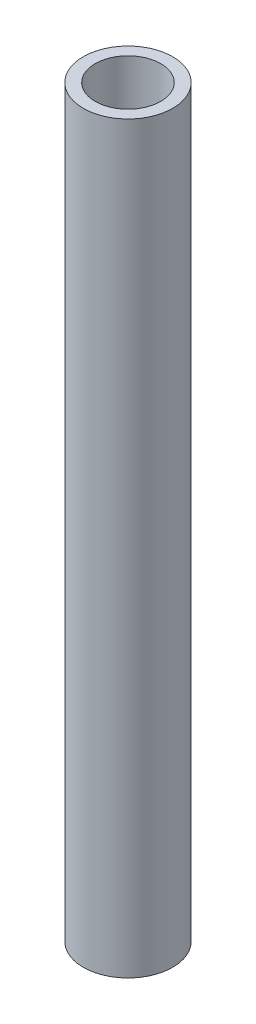
from build123d import *

# Parameters (mm, degrees)
SKETCH1_R           = 0.45085
SKETCH1_R_2         = 0.3302
BOSS_EXTRUDE1_DEPTH = 7.5


with BuildPart() as part:
    # Sketch1 → Boss-Extrude1 (new body)
    with BuildSketch(Plane(origin=(0, 0, 0), x_dir=(1, 0, 0), z_dir=(0, 1, 0))):
        with Locations(Location((0, 0, 0), (0, 0, 270))):
            Circle(SKETCH1_R)
        with Locations(Location((0, 0, 0), (0, 0, 270))):
            Circle(SKETCH1_R_2, mode=Mode.SUBTRACT)
    extrude(amount=BOSS_EXTRUDE1_DEPTH)


solid = part.part
